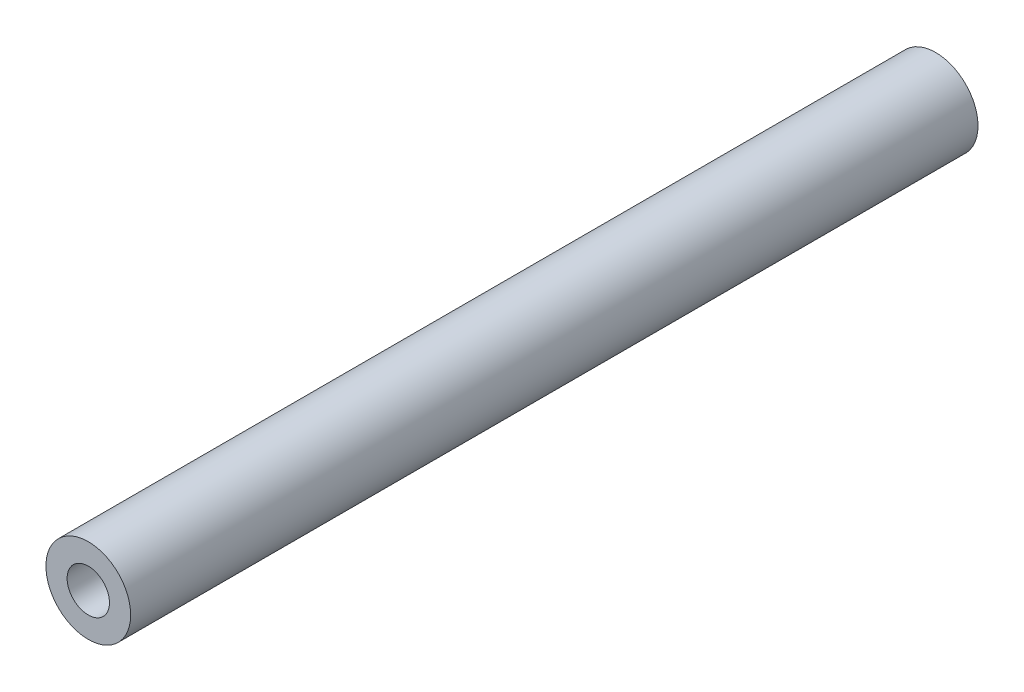
from build123d import *

# Parameters (mm, degrees)
SKETCH_1_R      = 3
SKETCH_1_R_2    = 1.5
EXTRUDE_1_DEPTH = 30


with BuildPart() as part:
    # 草图1 → 凸台-拉伸1 (new, symmetric)
    with BuildSketch(Plane.XY):
        Circle(SKETCH_1_R)
        Circle(SKETCH_1_R_2, mode=Mode.SUBTRACT)
    extrude(amount=EXTRUDE_1_DEPTH, both=True)


solid = part.part
